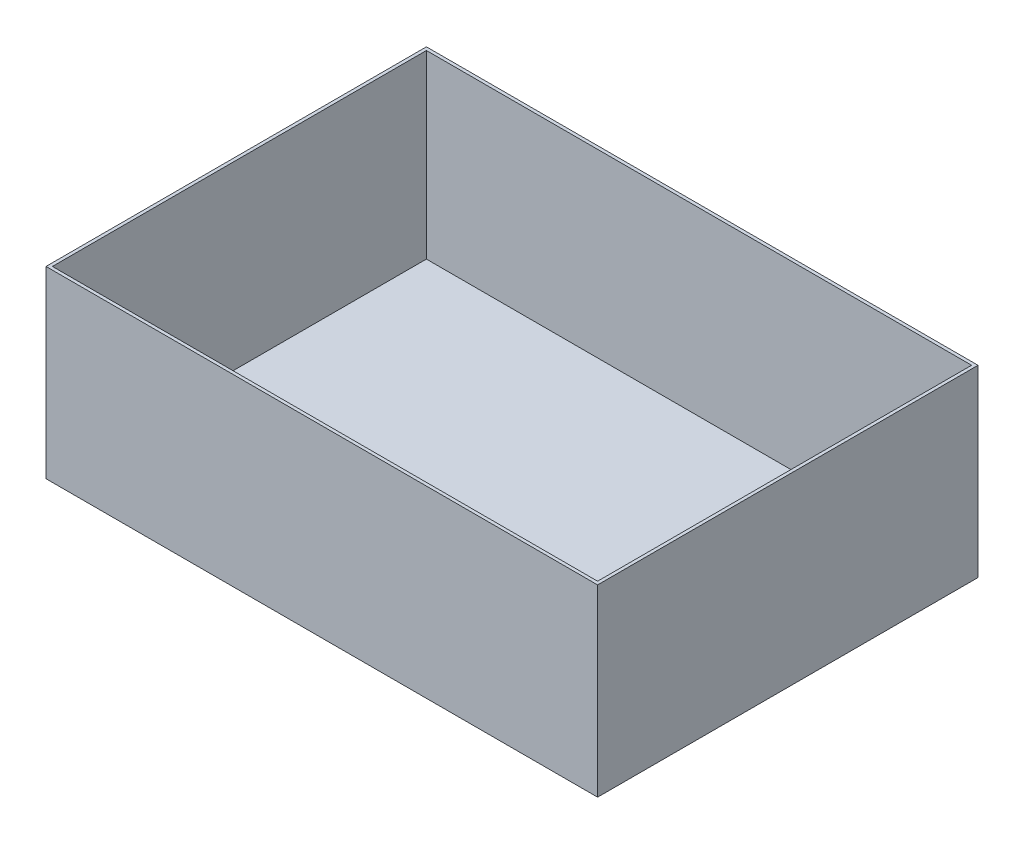
from build123d import *

# Parameters (mm, degrees)
SKETCH1_W           = 552.45
SKETCH1_H           = 381
BOSS_EXTRUDE1_DEPTH = 184.15
SHELL1_T            = -3.2


with BuildPart() as part:
    # Sketch1 → Boss-Extrude1 (new body)
    with BuildSketch(Plane(origin=(0, 0, 0), x_dir=(1, 0, 0), z_dir=(0, 1, 0))):
        Rectangle(SKETCH1_W, SKETCH1_H)
    extrude(amount=BOSS_EXTRUDE1_DEPTH)

    # Shell1
    shell1_openings = [part.faces().sort_by_distance(p)[0] for p in [
        (0, 184.15, 0),
    ]]
    offset(amount=SHELL1_T, openings=shell1_openings, kind=Kind.INTERSECTION)


solid = part.part
